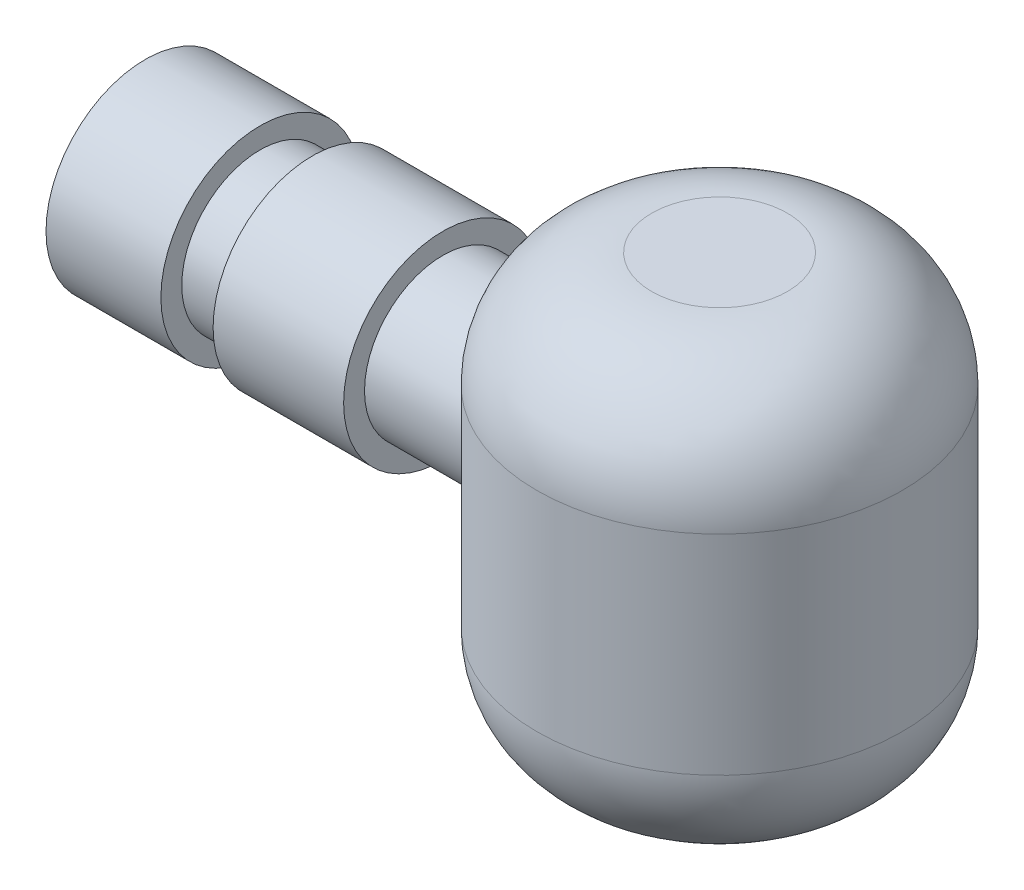
from build123d import *

# Parameters (mm, degrees)
SKETCH_2_R          = 35
EXTRUDE_1_DEPTH     = 42
FILLET_2_R          = 22
SKETCH_3_R          = 16
CUT_EXTRUDE_1_DEPTH = 20


with BuildPart() as part:
    # 草图1 → 旋转1 (revolve)
    with BuildSketch(Plane.XY, mode=Mode.PRIVATE) as revolve_1_sk:
        Polygon((0, 0), (0, 19), (22, 19), (22, 15), (32, 15), (32, 19), (57, 19), (57, 15), (112, 15), (112, 0), align=None)
    revolve(revolve_1_sk.sketch.rotate(Axis((0, 0, 0), (1, 0, 0)), 90), axis=Axis((0, 0, 0), (1, 0, 0)))

    # 草图2 → 凸台-拉伸1 (add, symmetric)
    with BuildSketch(Plane(origin=(0, 0, 0), x_dir=(1, 0, 0), z_dir=(0, 1, 0))):
        with Locations(Location((110, 0, 0), (0, 0, 270))):
            Circle(SKETCH_2_R)
    extrude(amount=EXTRUDE_1_DEPTH, both=True)

    # 圆角2
    fillet_2_edges = [part.edges().sort_by_distance(p)[0] for p in [
        (110, -42, -35),
        (110, 42, -35),
    ]]
    fillet(fillet_2_edges, radius=FILLET_2_R)

    # 草图3 → 切除-拉伸1 (cut)
    with BuildSketch(Plane.ZY):
        Circle(SKETCH_3_R)
    extrude(amount=-CUT_EXTRUDE_1_DEPTH, mode=Mode.SUBTRACT)


solid = part.part
